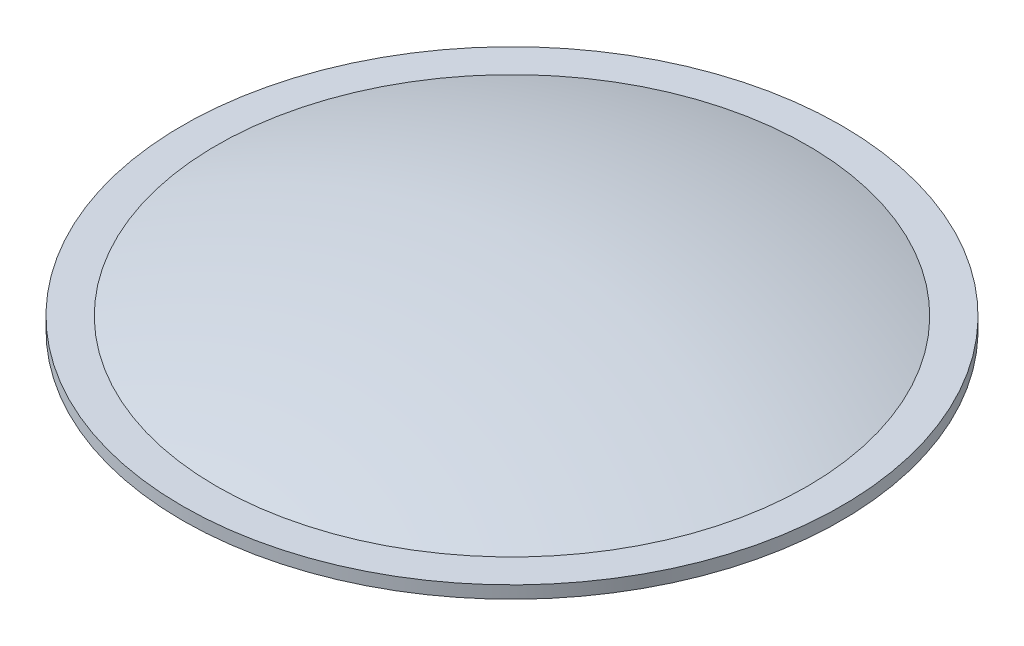
from build123d import *


with BuildPart() as part:
    # Sketch2 → Revolve1 (revolve)
    with BuildSketch(Plane.XY):
        with BuildLine():
            Line((26.43, 1), (23.69, 1))
            ThreePointArc((23.69, 1), (12.011697929, 3.984343492), (0, 4.988414296))
            Line((0, 4.988414296), (0, 0))
            Line((0, 0), (26.43, 0))
            Line((26.43, 0), (26.43, 1))
        make_face()
    revolve(axis=Axis((0, 49.298999736, 0), (0, -1, 0)))


solid = part.part
